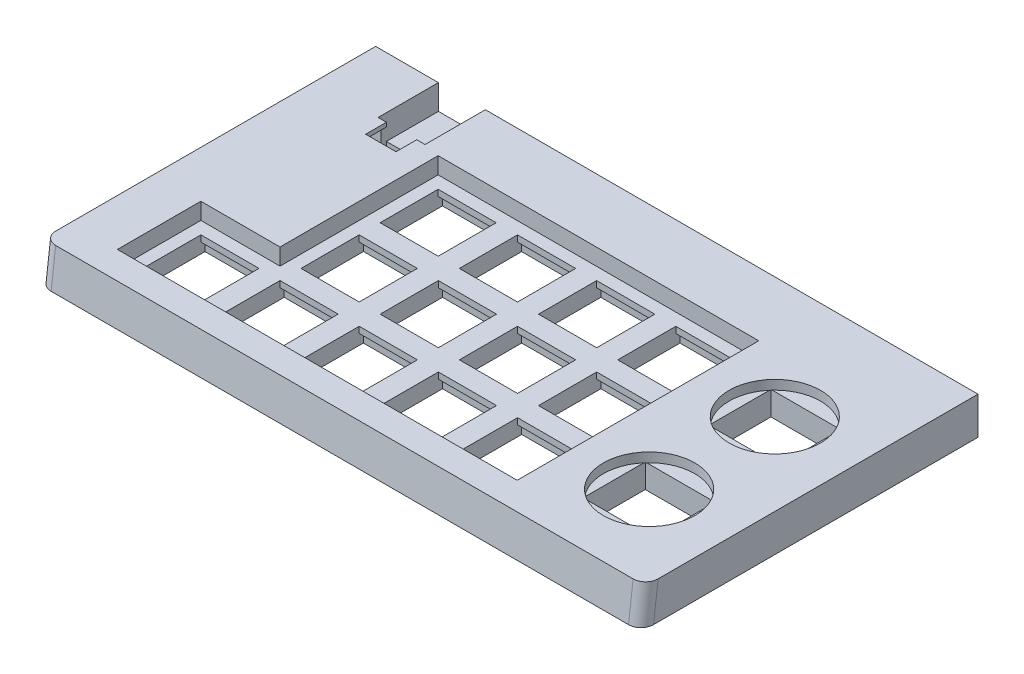
from build123d import *

# Parameters (mm, degrees)
SKETCH1_W           = 14
SKETCH1_H           = 14
SKETCH1_W_2         = 13.96
SKETCH1_H_2         = 13.96
SKETCH1_W_3         = 17.83
SKETCH1_H_3         = 34.365
SKETCH1_W_4         = 16.8
SKETCH1_H_4         = 14.955
BOSS_EXTRUDE2_DEPTH = 4
SKETCH3_W           = 14
SKETCH3_H           = 16
CUT_EXTRUDE1_DEPTH  = 2.5
SKETCH6_W           = 145
SKETCH6_H           = 81.124541
BOSS_EXTRUDE3_DEPTH = 8
SKETCH12_R          = 1.25
CUT_EXTRUDE5_DEPTH  = 6
SKETCH13_W          = 18.93
SKETCH13_H          = 35
CUT_EXTRUDE6_DEPTH  = 7
SKETCH14_W          = 16.8
SKETCH14_H          = 14.955
CUT_EXTRUDE8_DEPTH  = 5.75
SKETCH15_R          = 4
CUT_EXTRUDE9_DEPTH  = 10
SKETCH16_R          = 11
CUT_EXTRUDE10_DEPTH = 2.25
SKETCH20_W          = 145
SKETCH20_H          = 81.124541
SKETCH20_W_2        = 130
SKETCH20_H_2        = 66.1
BOSS_EXTRUDE5_DEPTH = 1
SKETCH21_W          = 145
SKETCH21_H          = 34.866824831
CUT_EXTRUDE11_DEPTH = 18
FILLET1_R           = 3
SKETCH28_W          = 11.3
SKETCH28_H          = 2
CUT_EXTRUDE14_DEPTH = 10
SKETCH31_W          = 11.3
SKETCH31_H          = 6
CUT_EXTRUDE15_DEPTH = 16


with BuildPart() as part:
    # Sketch1 → Boss-Extrude2 (new body)
    with BuildSketch(Plane(origin=(0, 0, 0), x_dir=(1, 0, 0), z_dir=(0, 1, 0))):
        Polygon((0, 0), (109.34, 0), (130, 0), (130, 66.1), (0, 66.1), align=None)
        with Locations((51.87, 10.55)):
            Rectangle(SKETCH1_W, SKETCH1_H, mode=Mode.SUBTRACT)
        with Locations((32.81, 10.55)):
            Rectangle(SKETCH1_W, SKETCH1_H, mode=Mode.SUBTRACT)
        with Locations((32.81, 29.6)):
            Rectangle(SKETCH1_W, SKETCH1_H, mode=Mode.SUBTRACT)
        with Locations((32.79, 48.63)):
            Rectangle(SKETCH1_W_2, SKETCH1_H_2, mode=Mode.SUBTRACT)
        with Locations((13.145, 42.2325)):
            Rectangle(SKETCH1_W_3, SKETCH1_H_3, mode=Mode.SUBTRACT)
        with Locations((13.75, 10.55)):
            Rectangle(SKETCH1_W, SKETCH1_H, mode=Mode.SUBTRACT)
        with Locations((51.87, 29.6)):
            Rectangle(SKETCH1_W, SKETCH1_H, mode=Mode.SUBTRACT)
        with Locations((70.93, 10.55)):
            Rectangle(SKETCH1_W, SKETCH1_H, mode=Mode.SUBTRACT)
        with Locations((89.99, 10.55)):
            Rectangle(SKETCH1_W, SKETCH1_H, mode=Mode.SUBTRACT)
        with Locations((117.74, 14.4625)):
            Rectangle(SKETCH1_W_4, SKETCH1_H_4, mode=Mode.SUBTRACT)
        with Locations((70.93, 29.6)):
            Rectangle(SKETCH1_W, SKETCH1_H, mode=Mode.SUBTRACT)
        with Locations((89.99, 29.6)):
            Rectangle(SKETCH1_W, SKETCH1_H, mode=Mode.SUBTRACT)
        with Locations((51.87, 48.65)):
            Rectangle(SKETCH1_W, SKETCH1_H, mode=Mode.SUBTRACT)
        with Locations((70.93, 48.65)):
            Rectangle(SKETCH1_W, SKETCH1_H, mode=Mode.SUBTRACT)
        with Locations((89.99, 48.65)):
            Rectangle(SKETCH1_W, SKETCH1_H, mode=Mode.SUBTRACT)
        with Locations((117.74, 44.7175)):
            Rectangle(SKETCH1_W_4, SKETCH1_H_4, mode=Mode.SUBTRACT)
    extrude(amount=BOSS_EXTRUDE2_DEPTH)

    # Sketch3 → Cut-Extrude1 (cut)
    with BuildSketch(Plane(origin=(0, 0, 0), x_dir=(1, 0, 0), z_dir=(0, 1, 0))):
        with Locations((89.99, 29.6)):
            Rectangle(SKETCH3_W, SKETCH3_H)
        with Locations((70.93, 29.6)):
            Rectangle(SKETCH3_W, SKETCH3_H)
        with Locations((89.99, 48.65)):
            Rectangle(SKETCH3_W, SKETCH3_H)
        with Locations((70.93, 48.65)):
            Rectangle(SKETCH3_W, SKETCH3_H)
        with Locations((51.87, 48.65)):
            Rectangle(SKETCH3_W, SKETCH3_H)
        with Locations((32.81, 48.65)):
            Rectangle(SKETCH3_W, SKETCH3_H)
        with Locations((32.81, 29.650197757)):
            Rectangle(SKETCH3_W, SKETCH3_H)
        with Locations((51.87, 29.6)):
            Rectangle(SKETCH3_W, SKETCH3_H)
        with Locations((13.75, 10.55)):
            Rectangle(SKETCH3_W, SKETCH3_H)
        with Locations((32.81, 10.55)):
            Rectangle(SKETCH3_W, SKETCH3_H)
        with Locations((51.87, 10.55)):
            Rectangle(SKETCH3_W, SKETCH3_H)
        with Locations((70.93, 10.55)):
            Rectangle(SKETCH3_W, SKETCH3_H)
        with Locations((89.99, 10.55)):
            Rectangle(SKETCH3_W, SKETCH3_H)
    extrude(amount=CUT_EXTRUDE1_DEPTH, mode=Mode.SUBTRACT)

    # Sketch6 → Boss-Extrude3 (add)
    with BuildSketch(Plane(origin=(0, 0, 0), x_dir=(-1, 0, 0), z_dir=(0, -1, 0))):
        with Locations((-65, 33.3140765)):
            Rectangle(SKETCH6_W, SKETCH6_H)
        Polygon((-99.99, 58.61), (-39.77, 58.61), (-22.81, 58.61), (-22.81, 53.222321133), (-22.81, 20.55), (-3.75, 20.55), (-3.75, 12.496372948), (-3.75, 0.461789698), (-20.75, 0.461789698), (-99.99, 0.461789698), align=None, mode=Mode.SUBTRACT)
    extrude(amount=-BOSS_EXTRUDE3_DEPTH)

    # Sketch12 → Cut-Extrude5 (cut)
    with BuildSketch(Plane(origin=(0, 0, 0), x_dir=(-1, 0, 0), z_dir=(0, -1, 0))):
        with BuildLine():
            ThreePointArc((-1, 63.85), (-1.366116524, 64.733883476), (-2.25, 65.1))
            Line((-2.25, 65.1), (-2.25, 63.85))
            Line((-2.25, 63.85), (-1, 63.85))
        make_face()
        with BuildLine():
            Line((-2.25, 63.85), (-2.25, 65.1))
            ThreePointArc((-2.25, 65.1), (-3.133883476, 62.966116524), (-1, 63.85))
            Line((-1, 63.85), (-2.25, 63.85))
        make_face()
        with BuildLine():
            ThreePointArc((-1, 2.25), (-3.133883476, 3.133883476), (-2.25, 1))
            Line((-2.25, 1), (-2.25, 2.25))
            Line((-2.25, 2.25), (-1, 2.25))
        make_face()
        with BuildLine():
            Line((-2.25, 2.25), (-2.25, 1))
            ThreePointArc((-2.25, 1), (-1.366116524, 1.366116524), (-1, 2.25))
            Line((-1, 2.25), (-2.25, 2.25))
        make_face()
        with BuildLine():
            ThreePointArc((-129, 2.25), (-128.633883476, 1.366116524), (-127.75, 1))
            Line((-127.75, 1), (-127.75, 2.25))
            Line((-127.75, 2.25), (-129, 2.25))
        make_face()
        with BuildLine():
            Line((-127.75, 2.25), (-127.75, 1))
            ThreePointArc((-127.75, 1), (-126.866116524, 1.366116524), (-126.5, 2.25))
            ThreePointArc((-126.5, 2.25), (-127.75, 3.5), (-129, 2.25))
            Line((-129, 2.25), (-127.75, 2.25))
        make_face()
        with Locations(Location((-127.75, 63.819224339, 0), (0, 0, 90))):
            Circle(SKETCH12_R)
    extrude(amount=-CUT_EXTRUDE5_DEPTH, mode=Mode.SUBTRACT)

    # Sketch13 → Cut-Extrude6 (cut)
    with BuildSketch(Plane.XZ):
        with Locations((13.235, -42.55)):
            Rectangle(SKETCH13_W, SKETCH13_H)
    extrude(amount=-CUT_EXTRUDE6_DEPTH, mode=Mode.SUBTRACT)

    # Sketch14 → Cut-Extrude8 (cut)
    with BuildSketch(Plane.XZ):
        with Locations((117.74, -14.4625)):
            Rectangle(SKETCH14_W, SKETCH14_H)
        with Locations((117.74, -44.7175)):
            Rectangle(SKETCH14_W, SKETCH14_H)
    extrude(amount=-CUT_EXTRUDE8_DEPTH, mode=Mode.SUBTRACT)

    # Sketch15 → Cut-Extrude9 (cut)
    with BuildSketch(Plane.XZ):
        with Locations(Location((117.74, -44.7175, 0), (0, 0, 270))):
            Circle(SKETCH15_R)
        with Locations(Location((117.74, -14.4625, 0), (0, 0, 270))):
            Circle(SKETCH15_R)
    extrude(amount=-CUT_EXTRUDE9_DEPTH, mode=Mode.SUBTRACT)

    # Sketch16 → Cut-Extrude10 (cut)
    with BuildSketch(Plane(origin=(0, 8, 0), x_dir=(1, 0, 0), z_dir=(0, 1, 0))):
        with Locations(Location((117.74, 44.7175, 0), (0, 0, 270))):
            Circle(SKETCH16_R)
        with Locations(Location((117.74, 14.4625, 0), (0, 0, 270))):
            Circle(SKETCH16_R)
    extrude(amount=-CUT_EXTRUDE10_DEPTH, mode=Mode.SUBTRACT)

    # Sketch20 → Boss-Extrude5 (add)
    with BuildSketch(Plane.XZ):
        with Locations((65, -33.3140765)):
            Rectangle(SKETCH20_W, SKETCH20_H)
        with Locations((65, -33.05)):
            Rectangle(SKETCH20_W_2, SKETCH20_H_2, mode=Mode.SUBTRACT)
    extrude(amount=BOSS_EXTRUDE5_DEPTH)

    # Sketch21 → Cut-Extrude11 (cut)
    with BuildSketch(Plane(origin=(0, -1.861896279, 0.228612117), x_dir=(-1, 0, 0), z_dir=(0, 0.9925461516413211, -0.1218693434051548))):
        with Locations((-65, 24.505710134)):
            Rectangle(SKETCH21_W, SKETCH21_H)
    extrude(amount=CUT_EXTRUDE11_DEPTH, mode=Mode.SUBTRACT)

    # Fillet1
    fillet1_edges = [part.edges().sort_by_distance(p)[0] for p in [
        (-7.5, 3.5, 6.695663476),
        (137.5, 3.5, 6.695663476),
    ]]
    fillet(fillet1_edges, radius=FILLET1_R)

    # Sketch28 → Cut-Extrude14 (cut)
    with BuildSketch(Plane.XZ):
        Polygon((16.91, -59.36), (16.91, -55.61), (16.91, -54.36), (9.61, -54.36), (9.61, -59.36), align=None)
        with Locations((13.26, -60.36)):
            Rectangle(SKETCH28_W, SKETCH28_H)
    extrude(amount=-CUT_EXTRUDE14_DEPTH, mode=Mode.SUBTRACT)

    # Sketch31 → Cut-Extrude15 (cut)
    with BuildSketch(Plane.XY.offset(-61.36)):
        with Locations((13.26, 5)):
            Rectangle(SKETCH31_W, SKETCH31_H)
    extrude(amount=-CUT_EXTRUDE15_DEPTH, mode=Mode.SUBTRACT)


solid = part.part
